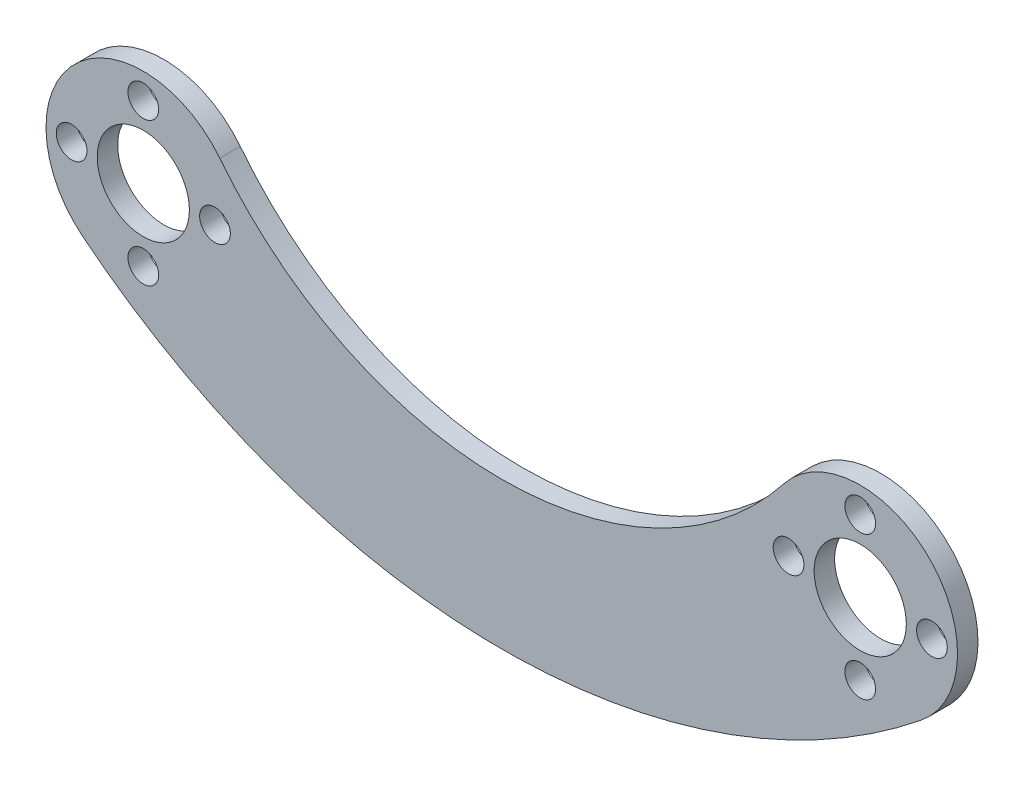
from build123d import *

# Parameters (mm, degrees)
EXTRUDE_1_DEPTH     = 2
SKETCH_2_R          = 4.5
SKETCH_2_R_2        = 1.5
CUT_EXTRUDE_1_DEPTH = 2


with BuildPart() as part:
    # 草图1 → 凸台-拉伸1 (new body)
    with BuildSketch(Plane.XY):
        with BuildLine():
            ThreePointArc((-27.528089888, 5.866903721), (-41.670339741, 6.764360114), (-40.970905632, -7.389065295))
            ThreePointArc((-40.970905632, -7.389065295), (0, -21.87378703), (40.970905632, -7.389065295))
            ThreePointArc((40.970905632, -7.389065295), (41.670339741, 6.764360114), (27.528089888, 5.866903721))
            ThreePointArc((27.528089888, 5.866903721), (0, -7.518187833), (-27.528089888, 5.866903721))
        make_face()
    extrude(amount=EXTRUDE_1_DEPTH)

    # 草图2 → 切除-拉伸1 (cut)
    with BuildSketch(Plane.XY.offset(2)):
        with Locations((35, 0)):
            Circle(SKETCH_2_R)
        with Locations((-35, 0)):
            Circle(SKETCH_2_R)
        with Locations((-28, 0)):
            Circle(SKETCH_2_R_2)
        with Locations((-35, -7)):
            Circle(SKETCH_2_R_2)
        with Locations((-42, 0)):
            Circle(SKETCH_2_R_2)
        with Locations((-35, 7)):
            Circle(SKETCH_2_R_2)
        with Locations((28, 0)):
            Circle(SKETCH_2_R_2)
        with Locations((35, 7)):
            Circle(SKETCH_2_R_2)
        with Locations((42, 0)):
            Circle(SKETCH_2_R_2)
        with Locations((35, -7)):
            Circle(SKETCH_2_R_2)
    extrude(amount=-CUT_EXTRUDE_1_DEPTH, mode=Mode.SUBTRACT)


solid = part.part
